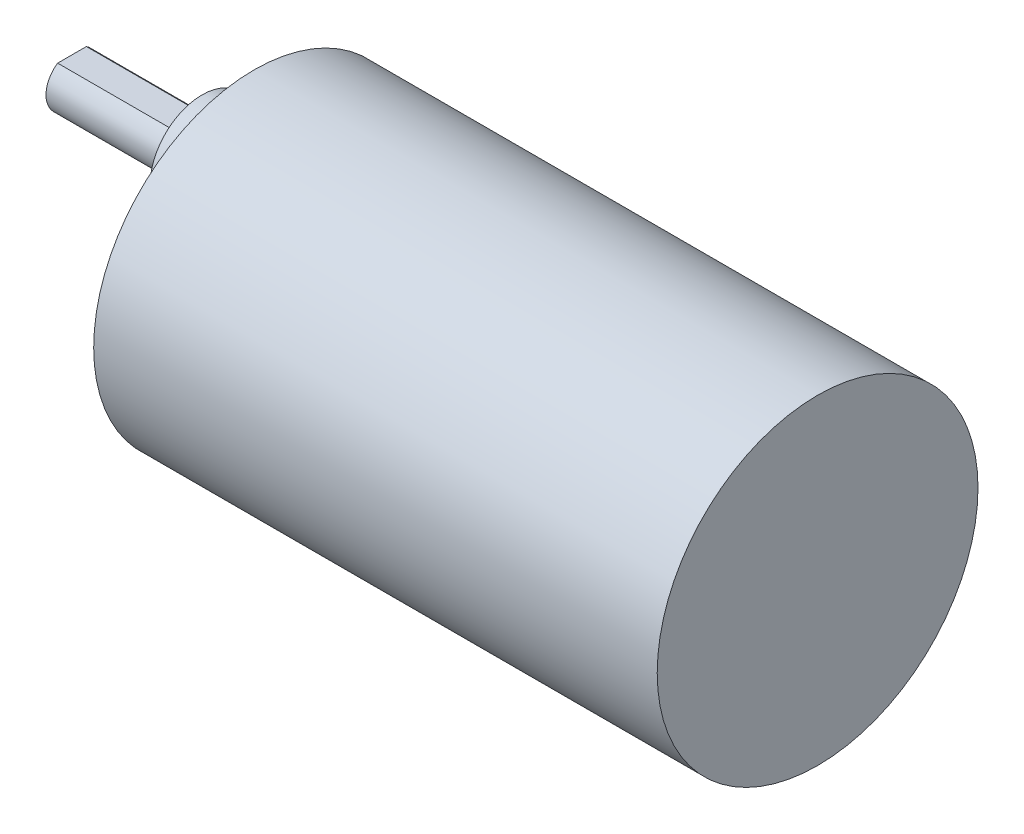
from build123d import *

# Parameters (mm, degrees)
SKIZZE1_R                       = 18.5
AUFSATZ_LINEAR_AUSTRAGEN1_DEPTH = 65
SKIZZE2_R                       = 6
AUFSATZ_LINEAR_AUSTRAGEN2_DEPTH = 6
AUFSATZ_LINEAR_AUSTRAGEN3_DEPTH = 15


with BuildPart() as part:
    # Skizze1 → Aufsatz-Linear austragen1 (new body)
    with BuildSketch(Plane(origin=(0, 0, 0), x_dir=(0, 0, -1), z_dir=(1, 0, 0))):
        Circle(SKIZZE1_R)
    extrude(amount=AUFSATZ_LINEAR_AUSTRAGEN1_DEPTH)

    # Skizze2 → Aufsatz-Linear austragen2 (add)
    with BuildSketch(Plane.ZY):
        with Locations(Location((0, 7, 0), (0, 0, 180))):
            Circle(SKIZZE2_R)
    extrude(amount=AUFSATZ_LINEAR_AUSTRAGEN2_DEPTH)

    # Skizze3 → Aufsatz-Linear austragen3 (add)
    with BuildSketch(Plane.ZY.offset(6)):
        with BuildLine():
            Line((-1.658312395, 9.5), (1.658312395, 9.5))
            ThreePointArc((1.658312395, 9.5), (0, 4), (-1.658312395, 9.5))
        make_face()
    extrude(amount=AUFSATZ_LINEAR_AUSTRAGEN3_DEPTH)


solid = part.part
